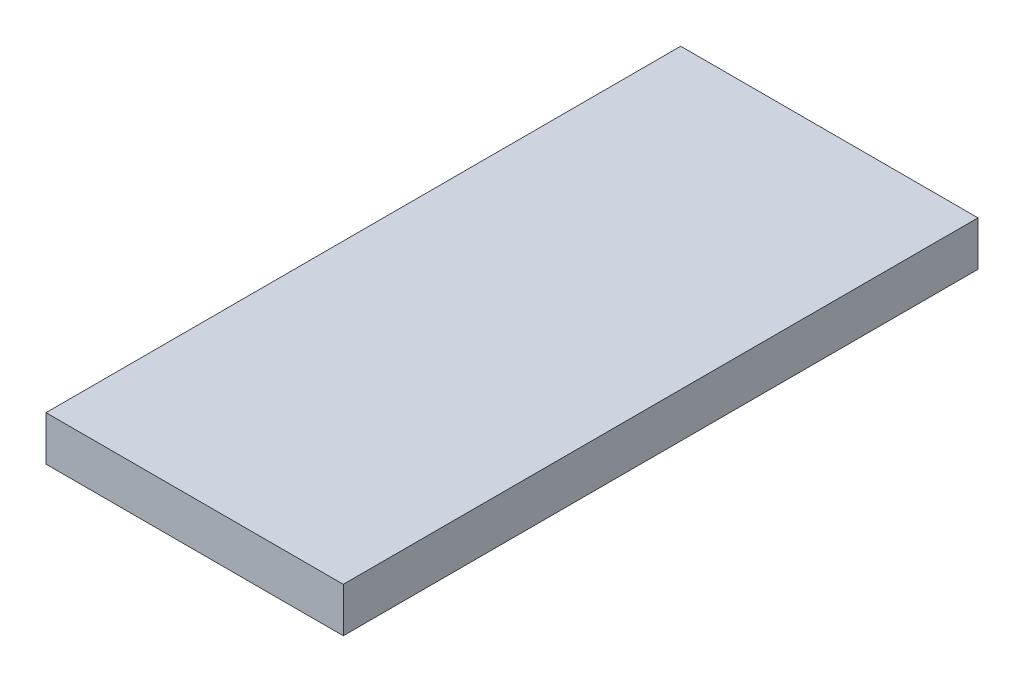
from build123d import *

# Parameters (mm, degrees)
SKETCH_1_W      = 100
SKETCH_1_H      = 15
EXTRUDE_1_DEPTH = 213.5


with BuildPart() as part:
    # 草图1 → 凸台-拉伸1 (new body)
    with BuildSketch(Plane.XY):
        Rectangle(SKETCH_1_W, SKETCH_1_H)
    extrude(amount=EXTRUDE_1_DEPTH)


solid = part.part
